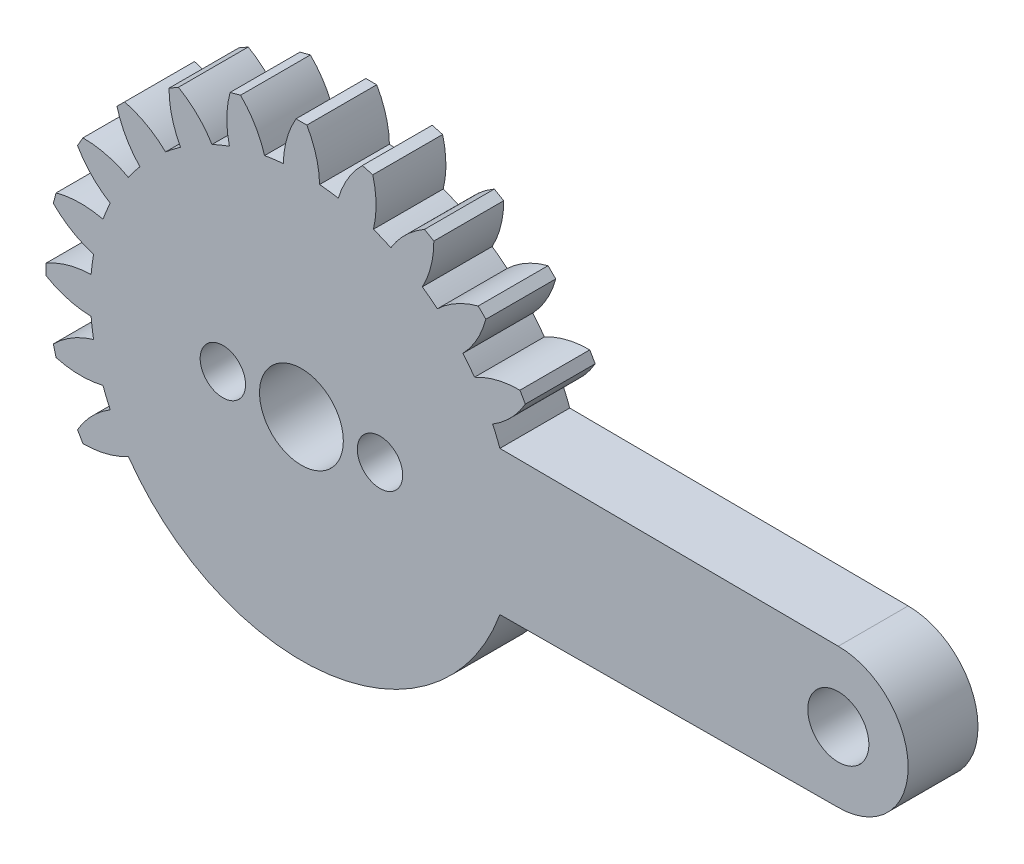
from build123d import *

# Parameters (mm, degrees)
SKETCH1_R           = 1.75
BOSS_EXTRUDE1_DEPTH = 4
SKETCH2_R           = 1.75
CUT_EXTRUDE2_DEPTH  = 38.915688046
SKETCH3_R           = 2.4
SKETCH3_R_2         = 1.3
CUT_EXTRUDE3_DEPTH  = 38.915688046


with BuildPart() as part:
    # Sketch1 → Boss-Extrude1 (new body)
    with BuildSketch(Plane.XY):
        with BuildLine():
            Line((0.31, 14.63), (-0.31, 14.63))
            ThreePointArc((-0.31, 14.63), (-0.838273314, 13.383704325), (-1.04, 12.04518576))
            ThreePointArc((-1.04, 12.04518576), (-1.578061664, 11.986568374), (-2.112960617, 11.903927815))
            ThreePointArc((-2.112960617, 11.903927815), (-2.65424773, 13.144626757), (-3.487085624, 14.211728743))
            Line((-3.487085624, 14.211728743), (-4.085959636, 14.051260935))
            ThreePointArc((-4.085959636, 14.051260935), (-4.273667417, 12.71070456), (-4.122086336, 11.365584201))
            ThreePointArc((-4.122086336, 11.365584201), (-4.626642697, 11.169703548), (-5.12192646, 10.951436862))
            ThreePointArc((-5.12192646, 10.951436862), (-5.965886177, 12.009764599), (-7.046532125, 12.824951657))
            Line((-7.046532125, 12.824951657), (-7.583467875, 12.514951657))
            ThreePointArc((-7.583467875, 12.514951657), (-7.417818147, 11.171491285), (-6.9232593, 9.911436862))
            ThreePointArc((-6.9232593, 9.911436862), (-7.359925677, 9.591641884), (-7.781841479, 9.252623584))
            ThreePointArc((-7.781841479, 9.252623584), (-8.870959341, 10.05645683), (-10.125769107, 10.564175311))
            Line((-10.125769107, 10.564175311), (-10.564175311, 10.125769107))
            ThreePointArc((-10.564175311, 10.125769107), (-10.05645683, 8.870959341), (-9.252623584, 7.781841479))
            ThreePointArc((-9.252623584, 7.781841479), (-9.591641884, 7.359925677), (-9.911436862, 6.9232593))
            ThreePointArc((-9.911436862, 6.9232593), (-11.171491285, 7.417818147), (-12.514951657, 7.583467875))
            Line((-12.514951657, 7.583467875), (-12.824951657, 7.046532125))
            ThreePointArc((-12.824951657, 7.046532125), (-12.009764599, 5.965886177), (-10.951436862, 5.12192646))
            ThreePointArc((-10.951436862, 5.12192646), (-11.169703548, 4.626642697), (-11.365584201, 4.122086336))
            ThreePointArc((-11.365584201, 4.122086336), (-12.71070456, 4.273667417), (-14.051260935, 4.085959636))
            Line((-14.051260935, 4.085959636), (-14.211728743, 3.487085624))
            ThreePointArc((-14.211728743, 3.487085624), (-13.144626757, 2.65424773), (-11.903927815, 2.112960617))
            ThreePointArc((-11.903927815, 2.112960617), (-11.986568374, 1.578061664), (-12.04518576, 1.04))
            ThreePointArc((-12.04518576, 1.04), (-13.383704325, 0.838273314), (-14.63, 0.31))
            Line((-14.63, 0.31), (-14.63, -0.31))
            ThreePointArc((-14.63, -0.31), (-13.383704325, -0.838273314), (-12.04518576, -1.04))
            ThreePointArc((-12.04518576, -1.04), (-11.986568374, -1.578061664), (-11.903927815, -2.112960617))
            ThreePointArc((-11.903927815, -2.112960617), (-13.144626757, -2.65424773), (-14.211728743, -3.487085624))
            Line((-14.211728743, -3.487085624), (-14.051260935, -4.085959636))
            ThreePointArc((-14.051260935, -4.085959636), (-12.71070456, -4.273667417), (-11.365584201, -4.122086336))
            ThreePointArc((-11.365584201, -4.122086336), (-11.169703548, -4.626642697), (-10.951436862, -5.12192646))
            ThreePointArc((-10.951436862, -5.12192646), (-12.009764599, -5.965886177), (-12.824951657, -7.046532125))
            Line((-12.824951657, -7.046532125), (-12.514951657, -7.583467875))
            ThreePointArc((-12.514951657, -7.583467875), (-11.171491285, -7.417818147), (-9.911436862, -6.9232593))
            ThreePointArc((-9.911436862, -6.9232593), (1.578061664, -11.986568374), (11.365584201, -4.122086336))
            Line((11.365584201, -4.122086336), (30.75, -4))
            ThreePointArc((30.75, -4), (34.75, 0), (30.75, 4))
            Line((30.75, 4), (11.365584201, 4.122086336))
            ThreePointArc((11.365584201, 4.122086336), (11.169703548, 4.626642697), (10.951436862, 5.12192646))
            ThreePointArc((10.951436862, 5.12192646), (12.009764599, 5.965886177), (12.824951657, 7.046532125))
            Line((12.824951657, 7.046532125), (12.514951657, 7.583467875))
            ThreePointArc((12.514951657, 7.583467875), (11.171491285, 7.417818147), (9.911436862, 6.9232593))
            ThreePointArc((9.911436862, 6.9232593), (9.591641884, 7.359925677), (9.252623584, 7.781841479))
            ThreePointArc((9.252623584, 7.781841479), (10.05645683, 8.870959341), (10.564175311, 10.125769107))
            Line((10.564175311, 10.125769107), (10.125769107, 10.564175311))
            ThreePointArc((10.125769107, 10.564175311), (8.870959341, 10.05645683), (7.781841479, 9.252623584))
            ThreePointArc((7.781841479, 9.252623584), (7.359925677, 9.591641884), (6.9232593, 9.911436862))
            ThreePointArc((6.9232593, 9.911436862), (7.417818147, 11.171491285), (7.583467875, 12.514951657))
            Line((7.583467875, 12.514951657), (7.046532125, 12.824951657))
            ThreePointArc((7.046532125, 12.824951657), (5.965886177, 12.009764599), (5.12192646, 10.951436862))
            ThreePointArc((5.12192646, 10.951436862), (4.626642697, 11.169703548), (4.122086336, 11.365584201))
            ThreePointArc((4.122086336, 11.365584201), (4.273667417, 12.71070456), (4.085959636, 14.051260935))
            Line((4.085959636, 14.051260935), (3.487085624, 14.211728743))
            ThreePointArc((3.487085624, 14.211728743), (2.65424773, 13.144626757), (2.112960617, 11.903927815))
            ThreePointArc((2.112960617, 11.903927815), (1.578061664, 11.986568374), (1.04, 12.04518576))
            ThreePointArc((1.04, 12.04518576), (0.838273314, 13.383704325), (0.31, 14.63))
        make_face()
        with Locations((30.75, 0)):
            Circle(SKETCH1_R, mode=Mode.SUBTRACT)
    extrude(amount=BOSS_EXTRUDE1_DEPTH)

    # Sketch2 → Cut-Extrude2 (cut, through all)
    with BuildSketch(Plane.XY.offset(4)):
        Circle(SKETCH2_R)
    extrude(amount=-CUT_EXTRUDE2_DEPTH, mode=Mode.SUBTRACT)

    # Sketch3 → Cut-Extrude3 (cut, through all)
    with BuildSketch(Plane.XY.offset(4)):
        Circle(SKETCH3_R)
        with Locations((-4.5, 0)):
            Circle(SKETCH3_R_2)
        with Locations((4.5, 0)):
            Circle(SKETCH3_R_2)
    extrude(amount=-CUT_EXTRUDE3_DEPTH, mode=Mode.SUBTRACT)


solid = part.part
